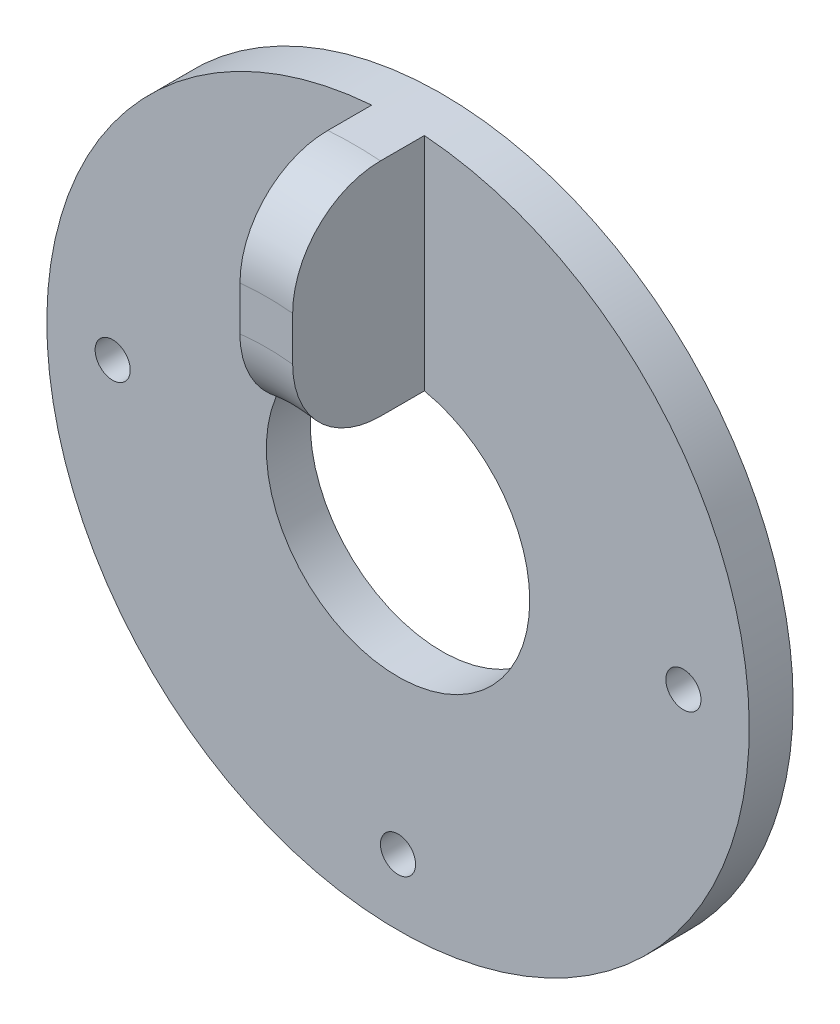
from build123d import *

# Parameters (mm, degrees)
SKETCH_1_R          = 40
EXTRUDE_1_DEPTH     = 5
SKETCH_3_R          = 15
CUT_EXTRUDE_1_DEPTH = 10
SKETCH_4_R          = 2
CUT_EXTRUDE_2_DEPTH = 10
EXTRUDE_2_DEPTH     = 15
FILLET_1_R          = 10


with BuildPart() as part:
    # 草图1 → 凸台-拉伸1 (new body)
    with BuildSketch(Plane.XY):
        Circle(SKETCH_1_R)
    extrude(amount=EXTRUDE_1_DEPTH)

    # 草图3 → 切除-拉伸1 (cut)
    with BuildSketch(Plane.XY.offset(5)):
        Circle(SKETCH_3_R)
    extrude(amount=-CUT_EXTRUDE_1_DEPTH, mode=Mode.SUBTRACT)

    # 草图4 → 切除-拉伸2 (cut)
    with BuildSketch(Plane.XY.offset(5)):
        with Locations((0, -32.5)):
            Circle(SKETCH_4_R)
        with Locations((32.5, 0)):
            Circle(SKETCH_4_R)
        with Locations((-32.5, 0)):
            Circle(SKETCH_4_R)
    extrude(amount=-CUT_EXTRUDE_2_DEPTH, mode=Mode.SUBTRACT)

    # 草图5 → 凸台-拉伸2 (add)
    with BuildSketch(Plane.XY.offset(5)):
        with BuildLine():
            Line((-3, 39.88734135), (-3, 14.696938457))
            ThreePointArc((-3, 14.696938457), (0, 15), (3, 14.696938457))
            Line((3, 14.696938457), (3, 39.88734135))
            ThreePointArc((3, 39.88734135), (0, 40), (-3, 39.88734135))
        make_face()
    extrude(amount=EXTRUDE_2_DEPTH)

    # 圆角1
    fillet_1_edges = [part.edges().sort_by_distance(p)[0] for p in [
        (0, 40, 20),
        (0, 15, 20),
    ]]
    fillet(fillet_1_edges, radius=FILLET_1_R)


solid = part.part
